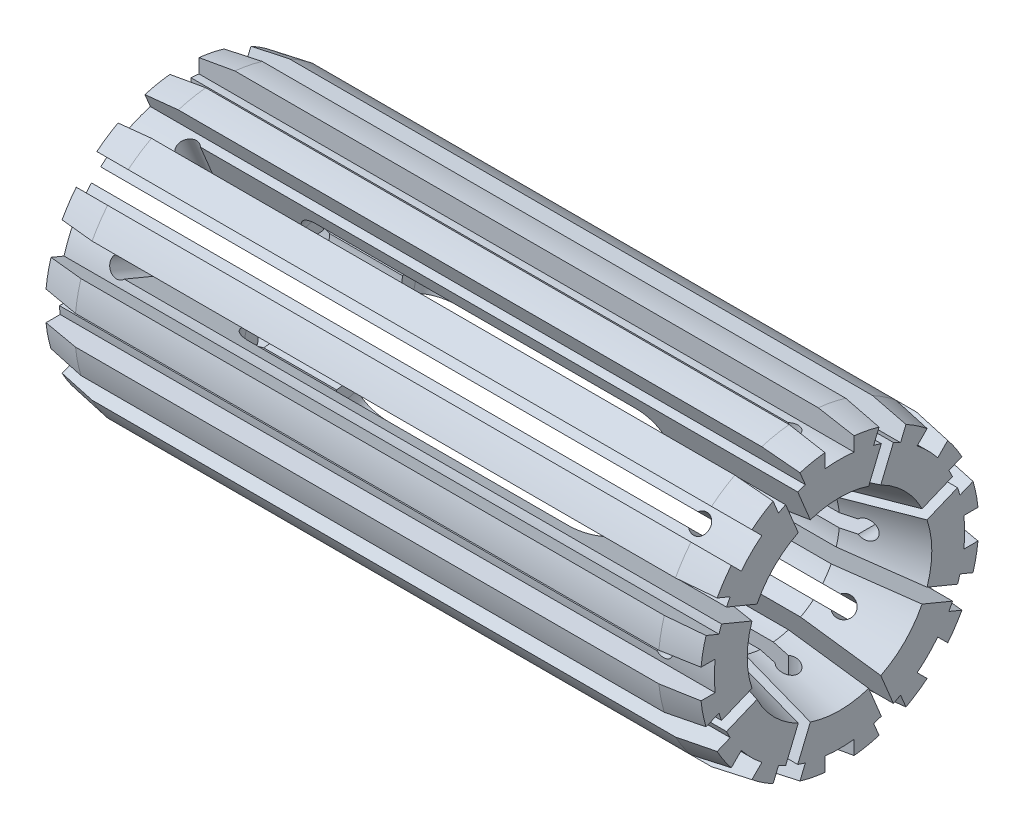
from build123d import *

# Parameters (mm, degrees)
CORTAR_EXTRUIR4_DEPTH = 120.811560377
MATRIZC1_COUNT        = 16
CORTAR_EXTRUIR5_DEPTH = 15.24
MATRIZC2_COUNT        = 8
CORTAR_EXTRUIR6_DEPTH = 15.24
MATRIZC3_COUNT        = 8


with BuildPart() as part:
    # Croquis1 → Revolución1 (revolve)
    with BuildSketch(Plane.XY, mode=Mode.PRIVATE) as revoluci_n1_sk:
        with BuildLine():
            Line((15.894836708, 12.7), (3.194836708, 12.7))
            Line((3.194836708, 12.7), (-9.505163292, 16.102954744))
            Line((-9.505163292, 16.102954744), (-9.505163292, 24.297334072))
            Line((-9.505163292, 24.297334072), (-3.251634061, 25.4))
            Line((-3.251634061, 25.4), (98.541307476, 25.4))
            Line((98.541307476, 25.4), (104.794836708, 24.297334072))
            Line((104.794836708, 24.297334072), (104.794836708, 16.102954744))
            Line((104.794836708, 16.102954744), (92.094836708, 12.7))
            Line((92.094836708, 12.7), (79.394836708, 12.7))
            Line((79.394836708, 12.7), (79.394836708, 15.24))
            ThreePointArc((79.394836708, 15.24), (78.278913544, 17.934076836), (75.584836708, 19.05))
            Line((75.584836708, 19.05), (19.704836708, 19.05))
            ThreePointArc((19.704836708, 19.05), (17.010759871, 17.934076836), (15.894836708, 15.24))
            Line((15.894836708, 15.24), (15.894836708, 12.7))
        make_face()
    revolve(revoluci_n1_sk.sketch.rotate(Axis((0, 0, 0), (1, 0, 0)), 90), axis=Axis((0, 0, 0), (1, 0, 0)))

    # Croquis2 → Cortar-Extruir4 (cut, through all)
    with BuildSketch(Plane(origin=(104.794836708, 0, 0), x_dir=(0, 0, -1), z_dir=(1, 0, 0))):
        with BuildLine():
            Line((2.54, 21.695823008), (2.54, 32.494414072))
            Line((2.54, 32.494414072), (-2.54, 32.494414072))
            Line((-2.54, 32.494414072), (-2.54, 21.695823008))
            ThreePointArc((-2.54, 21.695823008), (0, 21.844), (2.54, 21.695823008))
        make_face()
    cortar_extruir4 = extrude(amount=-CORTAR_EXTRUIR4_DEPTH, mode=Mode.SUBTRACT)

    # MatrizC1: Cortar-Extruir4 ×16 about axis
    matrizc1_axis = Axis((0, 0, 0), (1, 0, 0))
    for i in range(1, MATRIZC1_COUNT):
        add(cortar_extruir4.rotate(matrizc1_axis, i * 360 / MATRIZC1_COUNT), mode=Mode.SUBTRACT)

    # Croquis3 → Cortar-Extruir5 (cut)
    with BuildSketch(Plane(origin=(-9.505163292, 20.181224508, -8.359336897), x_dir=(1, 0, 0), z_dir=(0, 0.9238795325112865, -0.3826834323650906))):
        with BuildLine():
            Line((123.473476216, -1.143), (123.473476216, 1.143))
            Line((123.473476216, 1.143), (10.081365603, 1.143))
            ThreePointArc((10.081365603, 1.143), (7.239, 0), (10.081365603, -1.143))
            Line((10.081365603, -1.143), (123.473476216, -1.143))
        make_face()
    cortar_extruir5 = extrude(amount=-CORTAR_EXTRUIR5_DEPTH, mode=Mode.SUBTRACT)

    # MatrizC2: Cortar-Extruir5 ×8 about axis
    matrizc2_axis = Axis((0, 0, 0), (1, 0, 0))
    for i in range(1, MATRIZC2_COUNT):
        add(cortar_extruir5.rotate(matrizc2_axis, i * 360 / MATRIZC2_COUNT), mode=Mode.SUBTRACT)

    # Croquis4 → Cortar-Extruir6 (cut)
    with BuildSketch(Plane(origin=(104.794836708, 21.844, 0), x_dir=(1, 0, 0), z_dir=(0, 1, 0))):
        with BuildLine():
            Line((-124.908514794, -1.143), (-124.908514794, 1.143))
            Line((-124.908514794, 1.143), (-10.081365603, 1.143))
            ThreePointArc((-10.081365603, 1.143), (-7.239, 0), (-10.081365603, -1.143))
            Line((-10.081365603, -1.143), (-124.908514794, -1.143))
        make_face()
    cortar_extruir6 = extrude(amount=-CORTAR_EXTRUIR6_DEPTH, mode=Mode.SUBTRACT)

    # MatrizC3: Cortar-Extruir6 ×8 about axis
    matrizc3_axis = Axis((0, 0, 0), (1, 0, 0))
    for i in range(1, MATRIZC3_COUNT):
        add(cortar_extruir6.rotate(matrizc3_axis, i * 360 / MATRIZC3_COUNT), mode=Mode.SUBTRACT)


solid = part.part
